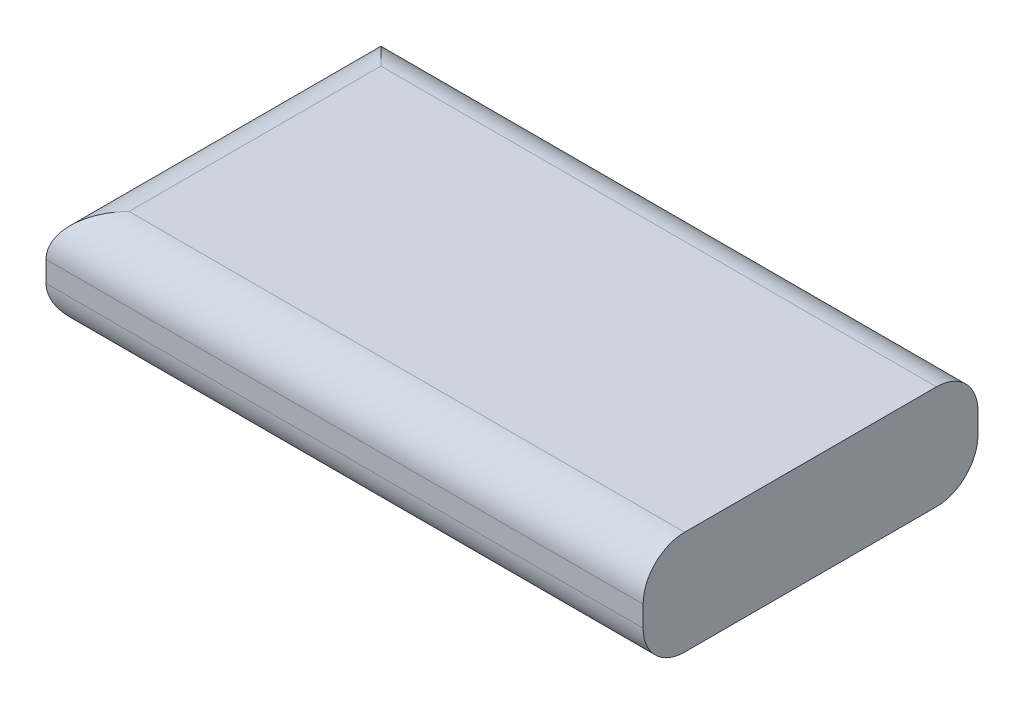
from build123d import *

# Parameters (mm, degrees)
SKETCH_1_W      = 46
SKETCH_1_H      = 25.8
EXTRUDE_1_DEPTH = 8
FILLET_1_R      = 3.2


with BuildPart() as part:
    # 草图1 → 凸台-拉伸1 (new body)
    with BuildSketch(Plane(origin=(0, 0, 0), x_dir=(1, 0, 0), z_dir=(0, 1, 0))):
        Rectangle(SKETCH_1_W, SKETCH_1_H)
    extrude(amount=EXTRUDE_1_DEPTH)

    # 圆角1
    fillet_1_edges = [part.edges().sort_by_distance(p)[0] for p in [
        (0, 8, -12.9),
        (-23, 8, 0),
        (0, 0, -12.9),
        (0, 0, 12.9),
        (-23, 0, 0),
        (0, 8, 12.9),
    ]]
    fillet(fillet_1_edges, radius=FILLET_1_R)


solid = part.part
